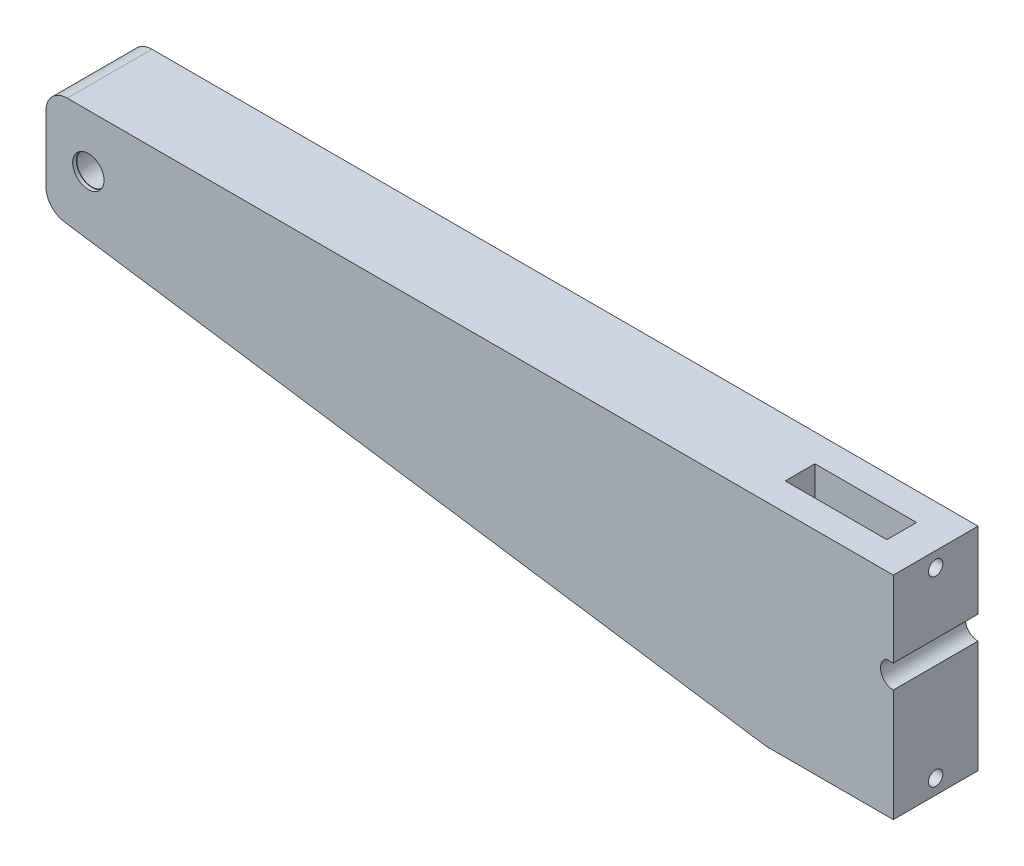
from build123d import *

# Parameters (mm, degrees)
SKETCH1_R           = 3.575
BOSS_EXTRUDE1_DEPTH = 20
FILLET1_R           = 5
SKETCH5_W           = 24
SKETCH5_H           = 7
CUT_EXTRUDE1_DEPTH  = 7
SKETCH6_R           = 1.7
CUT_EXTRUDE2_DEPTH  = 8
SKETCH3_R           = 3.7
CUT_EXTRUDE3_DEPTH  = 0.85


with BuildPart() as part:
    # Sketch1 → Boss-Extrude1 (new body)
    with BuildSketch(Plane.XY):
        with BuildLine():
            Line((-200, 25), (-30, 0))
            Line((-30, 0), (0, 0))
            Line((0, 0), (0, 26.5))
            ThreePointArc((0, 26.5), (-2.872281323, 28.633974596), (-1.658312395, 32))
            Line((-1.658312395, 32), (0, 32))
            Line((0, 32), (0, 32.5))
            Line((0, 32.5), (0, 50))
            Line((0, 50), (-200, 50))
            Line((-200, 50), (-200, 25))
        make_face()
        with Locations((-190, 37.5)):
            Circle(SKETCH1_R, mode=Mode.SUBTRACT)
    extrude(amount=BOSS_EXTRUDE1_DEPTH)

    # Fillet1
    fillet1_edges = [part.edges().sort_by_distance(p)[0] for p in [
        (-200, 25, 10),
        (-200, 50, 10),
    ]]
    fillet(fillet1_edges, radius=FILLET1_R)

    # Sketch5 → Cut-Extrude1 (cut)
    with BuildSketch(Plane(origin=(0, 50, 0), x_dir=(1, 0, 0), z_dir=(0, 1, 0))):
        with Locations((-20, -10)):
            Rectangle(SKETCH5_W, SKETCH5_H)
    cut_extrude1 = extrude(amount=-CUT_EXTRUDE1_DEPTH, mode=Mode.SUBTRACT)

    # Sketch6 → Cut-Extrude2 (cut)
    with BuildSketch(Plane.ZY.offset(8)):
        with Locations((10, 46.5)):
            Circle(SKETCH6_R)
    cut_extrude2 = extrude(amount=-CUT_EXTRUDE2_DEPTH, mode=Mode.SUBTRACT)

    # Mirror1: Cut-Extrude1, Cut-Extrude2 across plane
    add(cut_extrude1.mirror(Plane.ZX.offset(25)), mode=Mode.SUBTRACT)
    add(cut_extrude2.mirror(Plane.ZX.offset(25)), mode=Mode.SUBTRACT)

    # Sketch3 → Cut-Extrude3 (cut)
    with BuildSketch(Plane.XY.offset(20)):
        with Locations((-190, 37.5)):
            Circle(SKETCH3_R)
    cut_extrude3 = extrude(amount=-CUT_EXTRUDE3_DEPTH, mode=Mode.SUBTRACT)

    # Mirror2: Cut-Extrude3 across plane
    add(cut_extrude3.mirror(Plane.XY.offset(10)), mode=Mode.SUBTRACT)


solid = part.part
